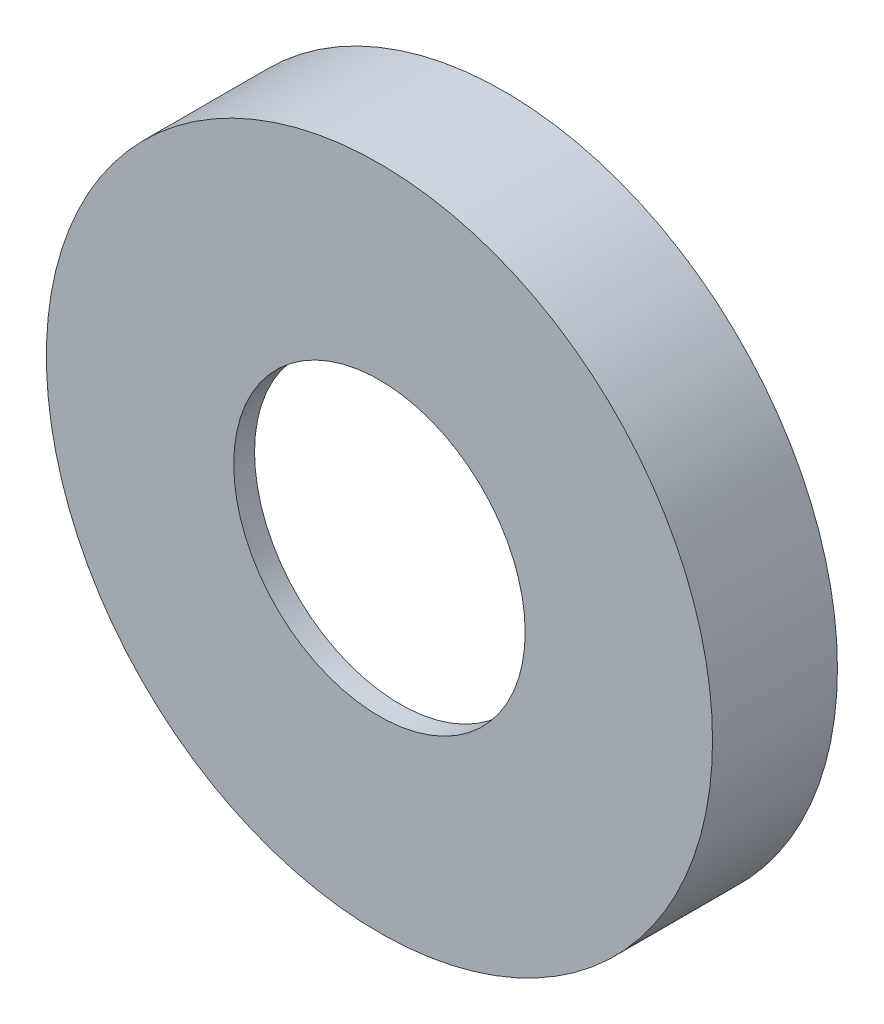
from build123d import *

# Parameters (mm, degrees)
SKETCH_1_R          = 8
EXTRUDE_1_DEPTH     = 3
SHELL_2_T           = -0.5
SKETCH_2_R          = 3.5
CUT_EXTRUDE_2_DEPTH = 12.704699911


with BuildPart() as part:
    # 草图1 → 拉伸1 (new body)
    with BuildSketch(Plane.XY):
        Circle(SKETCH_1_R)
    extrude(amount=EXTRUDE_1_DEPTH)

    # 抽壳2
    shell_2_openings = [part.faces().sort_by_distance(p)[0] for p in [
        (0, 0, 0),
    ]]
    offset(amount=SHELL_2_T, openings=shell_2_openings, kind=Kind.INTERSECTION)

    # 草图2 → 拉伸2 (cut, through all)
    with BuildSketch(Plane.XY.offset(3)):
        Circle(SKETCH_2_R)
    extrude(amount=-CUT_EXTRUDE_2_DEPTH, mode=Mode.SUBTRACT)


solid = part.part
